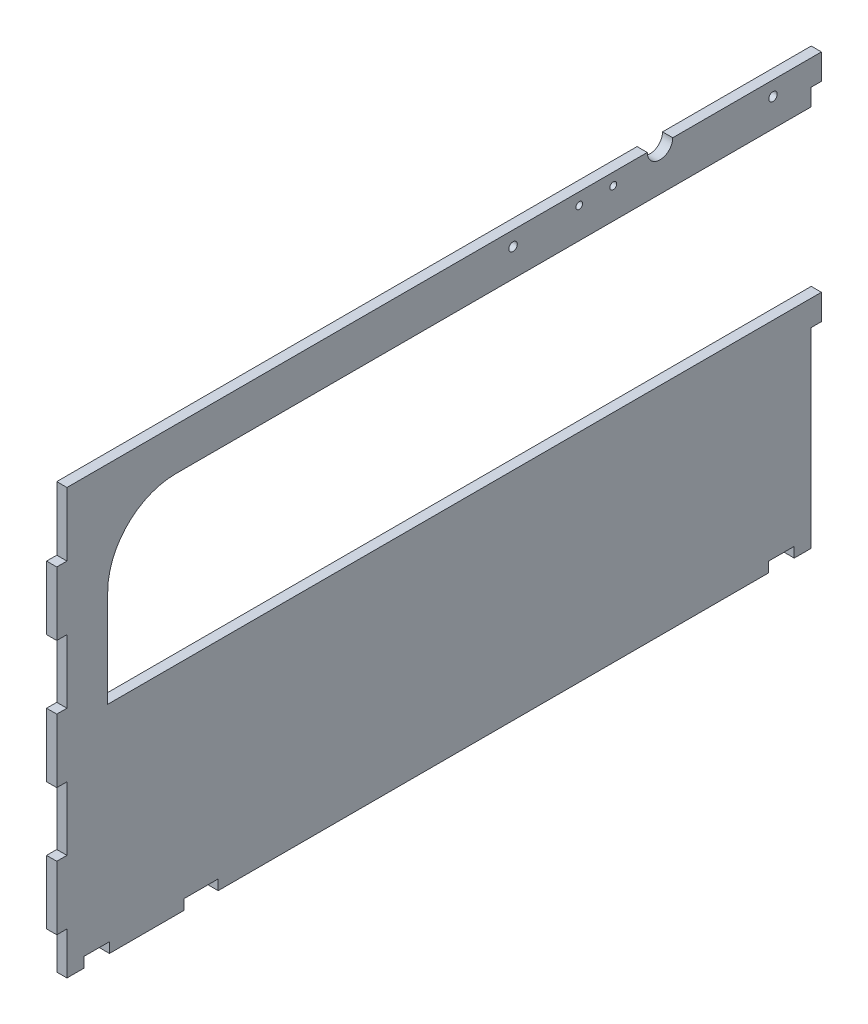
from build123d import *

# Parameters (mm, degrees)
BOSS_EXTRUDE1_DEPTH = 6
SKETCH2_W           = 6
SKETCH2_H           = 37.5
CUT_EXTRUDE1_DEPTH  = 6
LPATTERN1_COUNT     = 4
LPATTERN1_PITCH     = 75
FILLET1_R           = 40
SKETCH3_W           = 6
SKETCH3_H           = 10
SKETCH3_H_2         = 112.5
CUT_EXTRUDE2_DEPTH  = 515.816472153
SKETCH4_W           = 15
SKETCH4_H           = 6
CUT_EXTRUDE3_DEPTH  = 515.816472153
SKETCH5_R           = 2
CUT_EXTRUDE4_DEPTH  = 515.816472153
SKETCH6_W           = 20
SKETCH6_H           = 6
CUT_EXTRUDE5_DEPTH  = 515.816472153
SKETCH7_R           = 2.5
CUT_EXTRUDE6_DEPTH  = 515.816472153


with BuildPart() as part:
    # Sketch1 → Boss-Extrude1 (new body)
    with BuildSketch(Plane(origin=(0, 0, 0), x_dir=(0, 0, -1), z_dir=(1, 0, 0))):
        Polygon((450, 225), (450, 250), (0, 250), (0, 0), (450, 0), (450, 127.5), (30, 127.5), (30, 225), align=None)
    extrude(amount=BOSS_EXTRUDE1_DEPTH)

    # Sketch2 → Cut-Extrude1 (cut)
    with BuildSketch(Plane(origin=(6, 0, 0), x_dir=(0, 0, -1), z_dir=(1, 0, 0))):
        with Locations((3, 231.25)):
            Rectangle(SKETCH2_W, SKETCH2_H)
    cut_extrude1 = extrude(amount=-CUT_EXTRUDE1_DEPTH, mode=Mode.SUBTRACT)

    # LPattern1: Cut-Extrude1 ×4
    with Locations(*[(0, -i * LPATTERN1_PITCH, 0) for i in range(1, LPATTERN1_COUNT)]):
        add(cut_extrude1, mode=Mode.SUBTRACT)

    # Fillet1
    fillet1_edges = [part.edges().sort_by_distance(p)[0] for p in [
        (3, 225, -30),
    ]]
    fillet(fillet1_edges, radius=FILLET1_R)

    # Sketch3 → Cut-Extrude2 (cut, through all)
    with BuildSketch(Plane.ZY):
        with Locations((-447, 230)):
            Rectangle(SKETCH3_W, SKETCH3_H)
        with Locations((-447, 56.25)):
            Rectangle(SKETCH3_W, SKETCH3_H_2)
    extrude(amount=-CUT_EXTRUDE2_DEPTH, mode=Mode.SUBTRACT)

    # Sketch4 → Cut-Extrude3 (cut, through all)
    with BuildSketch(Plane.ZY):
        with Locations((-23.5, 3)):
            Rectangle(SKETCH4_W, SKETCH4_H)
        with Locations((-426.5, 3)):
            Rectangle(SKETCH4_W, SKETCH4_H)
    extrude(amount=-CUT_EXTRUDE3_DEPTH, mode=Mode.SUBTRACT)

    # Sketch5 → Cut-Extrude4 (cut, through all)
    with BuildSketch(Plane.ZY):
        with Locations((-327.5, 243)):
            Circle(SKETCH5_R)
        with Locations((-307.5, 243)):
            Circle(SKETCH5_R)
        with BuildLine():
            Line((-362.5, 250), (-347.5, 250))
            ThreePointArc((-347.5, 250), (-355, 242.5), (-362.5, 250))
        make_face()
    extrude(amount=-CUT_EXTRUDE4_DEPTH, mode=Mode.SUBTRACT)

    # Sketch6 → Cut-Extrude5 (cut, through all)
    with BuildSketch(Plane.ZY):
        with Locations((-85, 3)):
            Rectangle(SKETCH6_W, SKETCH6_H)
    extrude(amount=-CUT_EXTRUDE5_DEPTH, mode=Mode.SUBTRACT)

    # Sketch7 → Cut-Extrude6 (cut, through all)
    with BuildSketch(Plane.ZY):
        with Locations((-421.5, 241.5)):
            Circle(SKETCH7_R)
        with Locations((-268.51, 241.5)):
            Circle(SKETCH7_R)
    extrude(amount=-CUT_EXTRUDE6_DEPTH, mode=Mode.SUBTRACT)


solid = part.part
